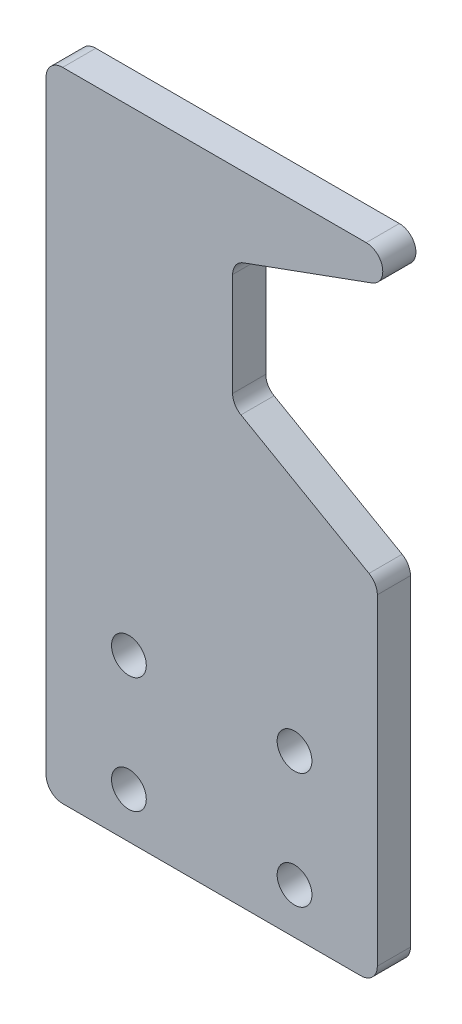
from build123d import *

# Parameters (mm, degrees)
EXTRUDE_1_DEPTH     = 4
CUT_EXTRUDE_1_REACH = 61.822
SKETCH_2_R          = 2.1
FILLET_1_R          = 2


with BuildPart() as part:
    # 草图1 → 凸台-拉伸1 (new body)
    with BuildSketch(Plane.XY):
        with BuildLine():
            Line((18.657436361, 56), (-20, 56))
            Line((-20, 56), (-20, 21))
            Line((-20, 21), (-20, -21))
            Line((-20, -21), (20, -21))
            Line((20, -21), (20, 21))
            Line((20, 21), (2.525225805, 31))
            Line((2.525225805, 31), (2.525225805, 46))
            Line((2.525225805, 46), (19.341476647, 52.120614758))
            ThreePointArc((19.341476647, 52.120614758), (20.627051867, 54.347296355), (18.657436361, 56))
        make_face()
    extrude(amount=EXTRUDE_1_DEPTH)

    # 草图2 → 切除-拉伸1 (cut, up to next)
    with BuildSketch(Plane.XY.offset(4), mode=Mode.PRIVATE) as cut_extrude_1_sk1:
        with Locations((-10, -15.5)):
            Circle(SKETCH_2_R)
    cut_extrude_1_tool1 = extrude(cut_extrude_1_sk1.sketch, amount=-CUT_EXTRUDE_1_REACH, mode=Mode.PRIVATE) & part.part
    # 草图2 → 切除-拉伸1 (cut, up to next)
    with BuildSketch(Plane.XY.offset(4), mode=Mode.PRIVATE) as cut_extrude_1_sk2:
        with Locations((-10, -1.5)):
            Circle(SKETCH_2_R)
    cut_extrude_1_tool2 = extrude(cut_extrude_1_sk2.sketch, amount=-CUT_EXTRUDE_1_REACH, mode=Mode.PRIVATE) & part.part
    # 草图2 → 切除-拉伸1 (cut, up to next)
    with BuildSketch(Plane.XY.offset(4), mode=Mode.PRIVATE) as cut_extrude_1_sk3:
        with Locations((10, -1.5)):
            Circle(SKETCH_2_R)
    cut_extrude_1_tool3 = extrude(cut_extrude_1_sk3.sketch, amount=-CUT_EXTRUDE_1_REACH, mode=Mode.PRIVATE) & part.part
    # 草图2 → 切除-拉伸1 (cut, up to next)
    with BuildSketch(Plane.XY.offset(4), mode=Mode.PRIVATE) as cut_extrude_1_sk4:
        with Locations((10, -15.5)):
            Circle(SKETCH_2_R)
    cut_extrude_1_tool4 = extrude(cut_extrude_1_sk4.sketch, amount=-CUT_EXTRUDE_1_REACH, mode=Mode.PRIVATE) & part.part
    add(cut_extrude_1_tool1.solids().sort_by_distance((-10, -15.5, 4))[0], mode=Mode.SUBTRACT)
    add(cut_extrude_1_tool2.solids().sort_by_distance((-10, -1.5, 4))[0], mode=Mode.SUBTRACT)
    add(cut_extrude_1_tool3.solids().sort_by_distance((10, -1.5, 4))[0], mode=Mode.SUBTRACT)
    add(cut_extrude_1_tool4.solids().sort_by_distance((10, -15.5, 4))[0], mode=Mode.SUBTRACT)

    # 圆角1
    fillet_1_edges = [part.edges().sort_by_distance(p)[0] for p in [
        (2.525225805, 46, 2),
        (2.525225805, 31, 2),
        (20, 21, 2),
        (20, -21, 2),
        (-20, -21, 2),
        (-20, 56, 2),
    ]]
    fillet(fillet_1_edges, radius=FILLET_1_R)


solid = part.part
